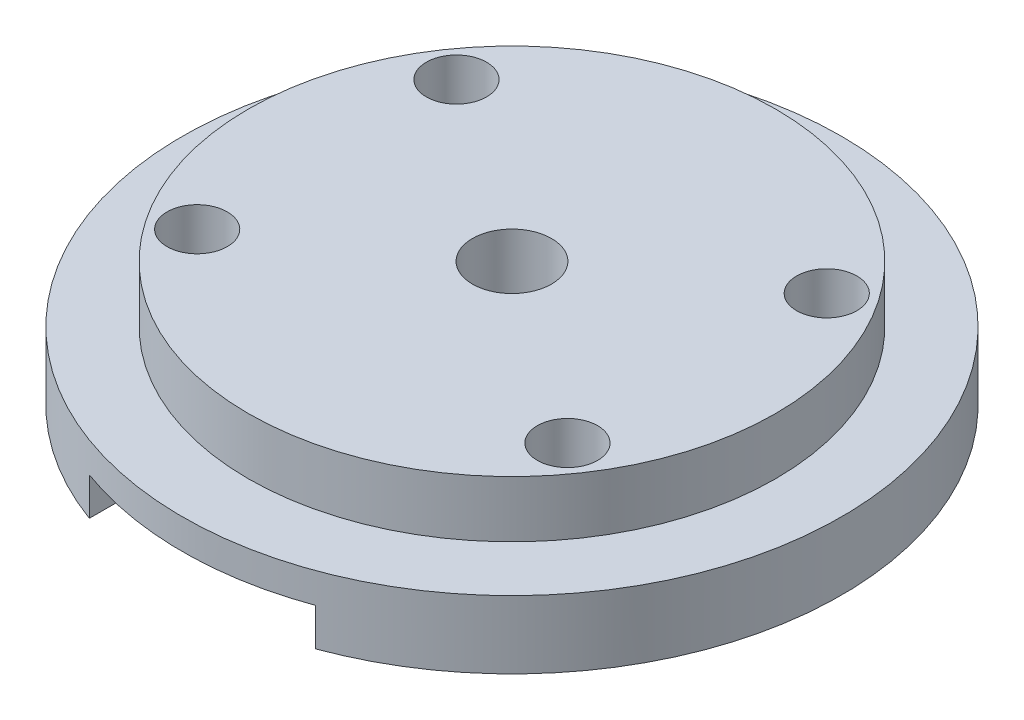
from build123d import *
from build123d.topology import SkipClean

# Parameters (mm, degrees)
SKETCH_1_R          = 14
SKETCH_1_R_2        = 2.1
EXTRUDE_1_DEPTH     = 3
EXTRUDE_START       = 1.6
SKETCH_3_R          = 17.5
SKETCH_3_R_2        = 2.1
EXTRUDE_2_DEPTH     = 1.6
EXTRUDE_START_2     = 2
EXTRUDE_5_DEPTH     = 2
SKETCH_8_R          = 1.6
CUT_EXTRUDE_2_DEPTH = 26.613668226


with BuildPart() as part:
    # ｽｹｯﾁ1 → ﾎﾞｽ - 押し出し1 (new body)
    with BuildSketch(Plane(origin=(0, 0, 0), x_dir=(1, 0, 0), z_dir=(0, 1, 0))):
        with Locations(Location((0, 0, 0), (0, 0, 270))):
            Circle(SKETCH_1_R)
        with Locations(Location((0, 0, 0), (0, 0, 270))):
            Circle(SKETCH_1_R_2, mode=Mode.SUBTRACT)
    extrude(amount=EXTRUDE_1_DEPTH)

    # ｽｹｯﾁ3 → ﾎﾞｽ - 押し出し2 (add)
    with SkipClean():  # the faces are left unmerged after this step: merging them gives an invalid solid
        with BuildSketch(Plane.XZ.offset(EXTRUDE_START)):
            with Locations(Location((0, 0, 0), (0, 0, 270))):
                Circle(SKETCH_3_R)
            with Locations(Location((0, 0, 0), (0, 0, 270))):
                Circle(SKETCH_3_R_2, mode=Mode.SUBTRACT)
        extrude(amount=-EXTRUDE_2_DEPTH)

    # ｽｹｯﾁ7 → ﾎﾞｽ - 押し出し5 (add)
    with BuildSketch(Plane.XZ.offset(1.6).offset(EXTRUDE_START_2)):
        with BuildLine():
            Line((-6, 16.439282223), (-6, -16.439282223))
            ThreePointArc((-6, -16.439282223), (-17.5, 0), (-6, 16.439282223))
        make_face()
        with BuildLine():
            Line((6, 16.439282223), (6, -16.439282223))
            ThreePointArc((6, -16.439282223), (17.5, 0), (6, 16.439282223))
        make_face()
    extrude(amount=-EXTRUDE_5_DEPTH)

    # ｽｹｯﾁ8 → ｶｯﾄ - 押し出し2 (cut, through all)
    with BuildSketch(Plane.XZ.offset(3.6)):
        with Locations(Location((9.829824531, 6.882917236, 0), (0, 0, 270))):
            Circle(SKETCH_8_R)
        with Locations(Location((-9.829824531, -6.882917236, 0), (0, 0, 90))):
            Circle(SKETCH_8_R)
        with Locations(Location((-9.829824531, 6.882917236, 0), (0, 0, 270))):
            Circle(SKETCH_8_R)
        with Locations(Location((9.829824531, -6.882917236, 0), (0, 0, 270))):
            Circle(SKETCH_8_R)
    extrude(amount=-CUT_EXTRUDE_2_DEPTH, mode=Mode.SUBTRACT)


solid = part.part
